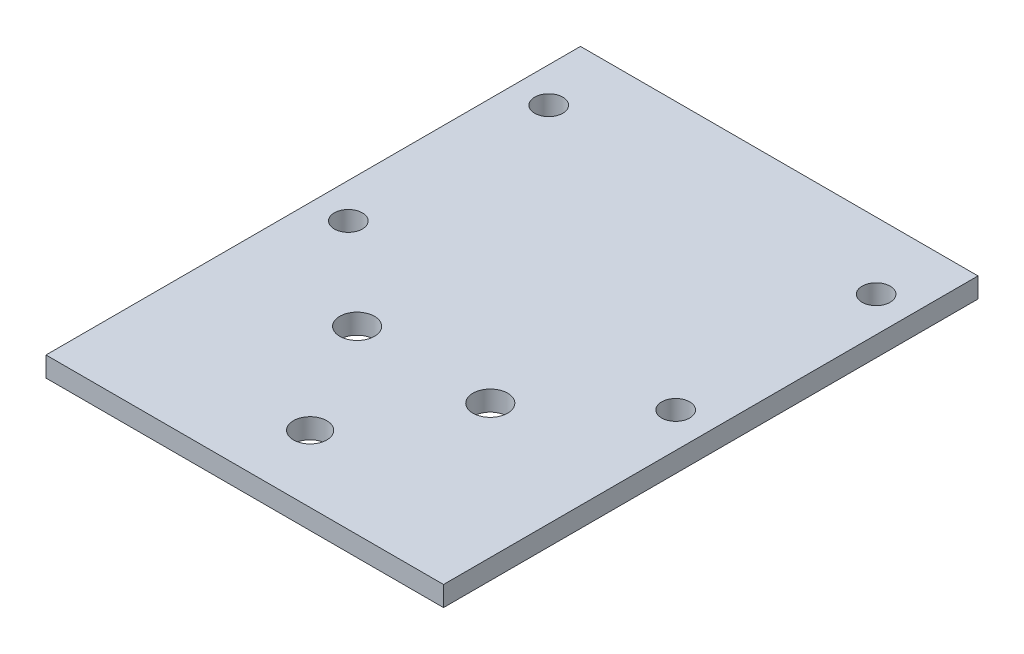
from build123d import *

# Parameters (mm, degrees)
SKETCH1_W           = 59.5
SKETCH1_H           = 80
SKETCH1_R           = 2.1
SKETCH1_R_2         = 2.6
BOSS_EXTRUDE1_DEPTH = 3
SKETCH2_R           = 2.5
CUT_EXTRUDE1_DEPTH  = 10


with BuildPart() as part:
    # Sketch1 → Boss-Extrude1 (new body)
    with BuildSketch(Plane(origin=(0, 0, 0), x_dir=(1, 0, 0), z_dir=(0, 1, 0))):
        Rectangle(SKETCH1_W, SKETCH1_H)
        with Locations(Location((24.5, 30, 0), (0, 0, 90))):
            Circle(SKETCH1_R, mode=Mode.SUBTRACT)
        with Locations(Location((-24.5, 30, 0), (0, 0, 270))):
            Circle(SKETCH1_R, mode=Mode.SUBTRACT)
        with Locations(Location((-24.5, 0, 0), (0, 0, 90))):
            Circle(SKETCH1_R, mode=Mode.SUBTRACT)
        with Locations(Location((24.5, 0, 0), (0, 0, 270))):
            Circle(SKETCH1_R, mode=Mode.SUBTRACT)
        with Locations(Location((9.75, -13, 0), (0, 0, 270))):
            Circle(SKETCH1_R_2, mode=Mode.SUBTRACT)
        with Locations(Location((-10.182503526, -13, 0), (0, 0, 270))):
            Circle(SKETCH1_R_2, mode=Mode.SUBTRACT)
    extrude(amount=BOSS_EXTRUDE1_DEPTH)

    # Sketch2 → Cut-Extrude1 (cut)
    with BuildSketch(Plane.XZ):
        with Locations(Location((-0.216251763, 30, 0), (0, 0, 270))):
            Circle(SKETCH2_R)
    extrude(amount=-CUT_EXTRUDE1_DEPTH, mode=Mode.SUBTRACT)


solid = part.part
